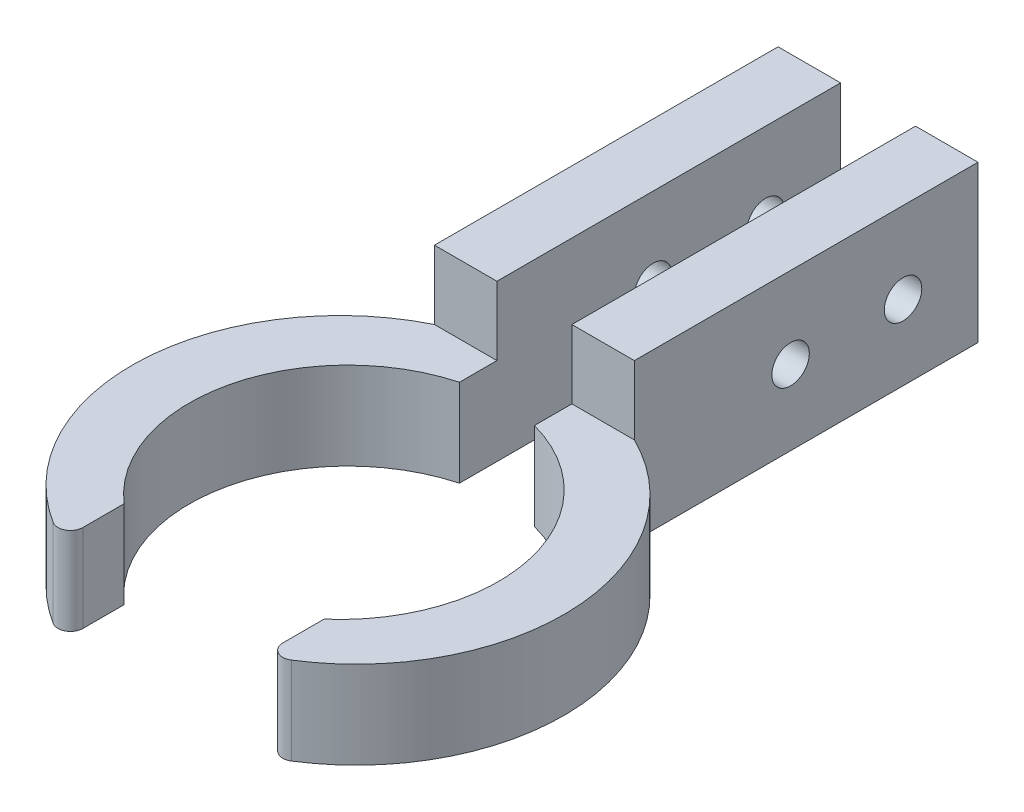
from build123d import *

# Parameters (mm, degrees)
SALIENTE_EXTRUIR1_DEPTH   = 7
SALIENTE_EXTRUIR1_2_DEPTH = 7
CROQUIS2_W                = 5
CROQUIS2_H                = 27.5
SALIENTE_EXTRUIR2_DEPTH   = 5.5
CORTAR_EXTRUIR1_REACH     = 53.917
CROQUIS3_R                = 1.5
REDONDEO1_R               = 1
REDONDEO2_R               = 1


with BuildPart() as part:
    # Croquis1 → Saliente-Extruir1 (new body)
    with BuildSketch(Plane(origin=(0, 0, 0), x_dir=(1, 0, 0), z_dir=(0, 1, 0))):
        with BuildLine():
            Line((2.5, -13.75), (2.5, -16.75))
            ThreePointArc((2.5, -16.75), (-6.555871294, -26.167614472), (-2.5, -38.587363876))
            Line((-2.5, -38.587363876), (-2.5, -43.587363876))
            ThreePointArc((-2.5, -43.587363876), (-11.782880045, -28.668681938), (-2.5, -13.75))
            Line((-2.5, -13.75), (-2.5, 13.75))
            Line((-2.5, 13.75), (2.5, 13.75))
            Line((2.5, 13.75), (2.5, -13.75))
        make_face()
    extrude(amount=SALIENTE_EXTRUIR1_DEPTH)



with BuildPart() as body_2:
    # Croquis1 → Saliente-Extruir1 2 (new body)
    with BuildSketch(Plane(origin=(0, 0, 0), x_dir=(1, 0, 0), z_dir=(0, 1, 0))):
        with BuildLine():
            Line((13.5, -38.587363876), (13.5, -43.587363876))
            ThreePointArc((13.5, -43.587363876), (22.782880045, -28.668681938), (13.5, -13.75))
            Line((13.5, -13.75), (13.5, 13.75))
            Line((13.5, 13.75), (8.5, 13.75))
            Line((8.5, 13.75), (8.5, -13.75))
            Line((8.5, -13.75), (8.5, -16.75))
            ThreePointArc((8.5, -16.75), (17.555871294, -26.167614472), (13.5, -38.587363876))
        make_face()
    extrude(amount=SALIENTE_EXTRUIR1_2_DEPTH)


with BuildPart() as part_1:
    add(part.part)

    add(body_2.part)  # Saliente-Extruir2 merges body 2
    # Croquis2 → Saliente-Extruir2 (add)
    with BuildSketch(Plane(origin=(0, 7, 0), x_dir=(1, 0, 0), z_dir=(0, 1, 0))):
        Rectangle(CROQUIS2_W, CROQUIS2_H)
        with Locations((11, 0)):
            Rectangle(CROQUIS2_W, CROQUIS2_H)
    extrude(amount=SALIENTE_EXTRUIR2_DEPTH)

    # Cortar-Extruir1: up to this face of the body (flat: up to its plane)
    cortar_extruir1_end = Plane(part_1.part.faces().sort_by_distance((-2.5, 6.25, 0))[0])
    # Croquis3 → Cortar-Extruir1 (cut, up to the picked face)
    with BuildSketch(Plane(origin=(13.5, 0, 0), x_dir=(0, 0, -1), z_dir=(1, 0, 0)), mode=Mode.PRIVATE) as cortar_extruir1_sk1:
        with Locations((7.75, 6)):
            Circle(CROQUIS3_R)
    cortar_extruir1_tool1 = split(extrude(cortar_extruir1_sk1.sketch, amount=-CORTAR_EXTRUIR1_REACH, mode=Mode.PRIVATE), bisect_by=cortar_extruir1_end, keep=Keep.BOTH, mode=Mode.PRIVATE)
    # Croquis3 → Cortar-Extruir1 (cut, up to the picked face)
    with BuildSketch(Plane(origin=(13.5, 0, 0), x_dir=(0, 0, -1), z_dir=(1, 0, 0)), mode=Mode.PRIVATE) as cortar_extruir1_sk2:
        with Locations((-1.25, 6)):
            Circle(CROQUIS3_R)
    cortar_extruir1_tool2 = split(extrude(cortar_extruir1_sk2.sketch, amount=-CORTAR_EXTRUIR1_REACH, mode=Mode.PRIVATE), bisect_by=cortar_extruir1_end, keep=Keep.BOTH, mode=Mode.PRIVATE)
    add(cortar_extruir1_tool1.solids().sort_by(Axis((13.5, 6, -7.75), (-1, 0, 0)))[0], mode=Mode.SUBTRACT)
    add(cortar_extruir1_tool2.solids().sort_by(Axis((13.5, 6, 1.25), (-1, 0, 0)))[0], mode=Mode.SUBTRACT)

    # Redondeo1
    redondeo1_edges = [part_1.edges().sort_by_distance(p)[0] for p in [
        (-2.5, 3.5, 43.587363876),
    ]]
    fillet(redondeo1_edges, radius=REDONDEO1_R)

    # Redondeo2
    redondeo2_edges = [part_1.edges().sort_by_distance(p)[0] for p in [
        (13.5, 3.5, 43.587363876),
    ]]
    fillet(redondeo2_edges, radius=REDONDEO2_R)


solid = part_1.part
